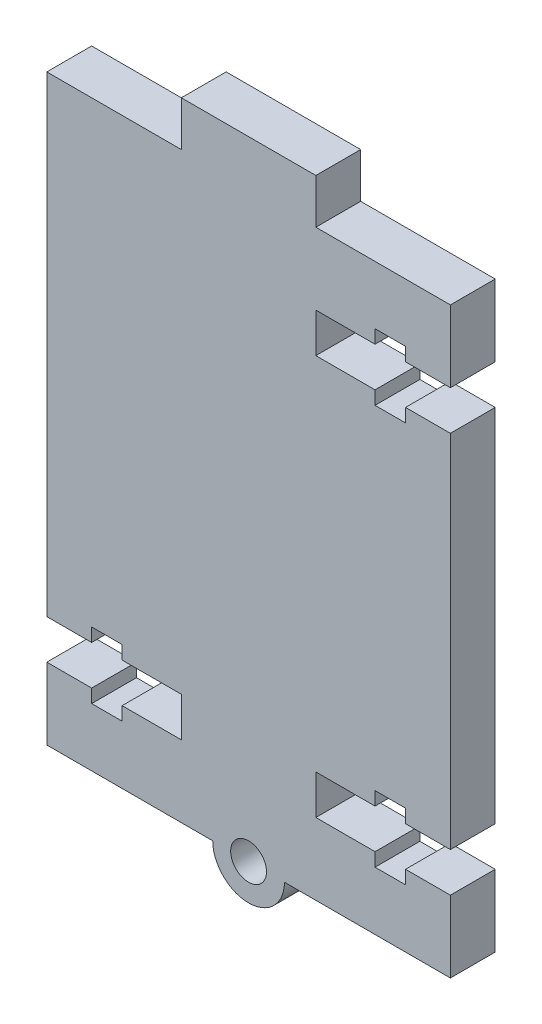
from build123d import *

# Parameters (mm, degrees)
BOSS_EXTRUDE1_DEPTH = 5
CUT_EXTRUDE1_DEPTH  = 5
SKETCH5_R           = 4
SKETCH5_R_2         = 2
BOSS_EXTRUDE2_DEPTH = 5
SKETCH6_R           = 2
CUT_EXTRUDE2_DEPTH  = 5


with BuildPart() as part:
    # Sketch1 → Boss-Extrude1 (new body)
    with BuildSketch(Plane.XY):
        Polygon((7.5, 32.5), (7.5, 37.5), (-7.5, 37.5), (-7.5, 32.5), (-22.5, 32.5), (-22.5, -32.5), (22.5, -32.5), (22.5, 32.5), align=None)
    extrude(amount=BOSS_EXTRUDE1_DEPTH)

    # Sketch3 → Cut-Extrude1 (cut)
    with BuildSketch(Plane.XY.offset(5)):
        Polygon((22.5, 24.5), (17.5, 24.5), (17.5, 26), (14.1, 26), (14.1, 24.5), (7.5, 24.5), (7.5, 20.1), (14.1, 20.1), (14.1, 18.6), (17.5, 18.6), (17.5, 20.1), (22.5, 20.1), align=None)
        Polygon((22.5, -24.5), (22.5, -20.1), (17.5, -20.1), (17.5, -18.6), (14.1, -18.6), (14.1, -20.1), (7.5, -20.1), (7.5, -24.5), (14.1, -24.5), (14.1, -26), (17.5, -26), (17.5, -24.5), align=None)
        Polygon((-22.5, -24.5), (-17.5, -24.5), (-17.5, -26), (-14.1, -26), (-14.1, -24.5), (-7.5, -24.5), (-7.5, -20.1), (-14.1, -20.1), (-14.1, -18.6), (-17.5, -18.6), (-17.5, -20.1), (-22.5, -20.1), align=None)
    extrude(amount=-CUT_EXTRUDE1_DEPTH, mode=Mode.SUBTRACT)

    # Sketch5 → Boss-Extrude2 (add)
    with BuildSketch(Plane.XY.offset(5)):
        with Locations((0, -32.5)):
            Circle(SKETCH5_R)
        with Locations((0, -32.5)):
            Circle(SKETCH5_R_2, mode=Mode.SUBTRACT)
    extrude(amount=-BOSS_EXTRUDE2_DEPTH)

    # Sketch6 → Cut-Extrude2 (cut)
    with BuildSketch(Plane.XY.offset(5)):
        with Locations((0, -32.5)):
            Circle(SKETCH6_R)
    extrude(amount=-CUT_EXTRUDE2_DEPTH, mode=Mode.SUBTRACT)


solid = part.part
